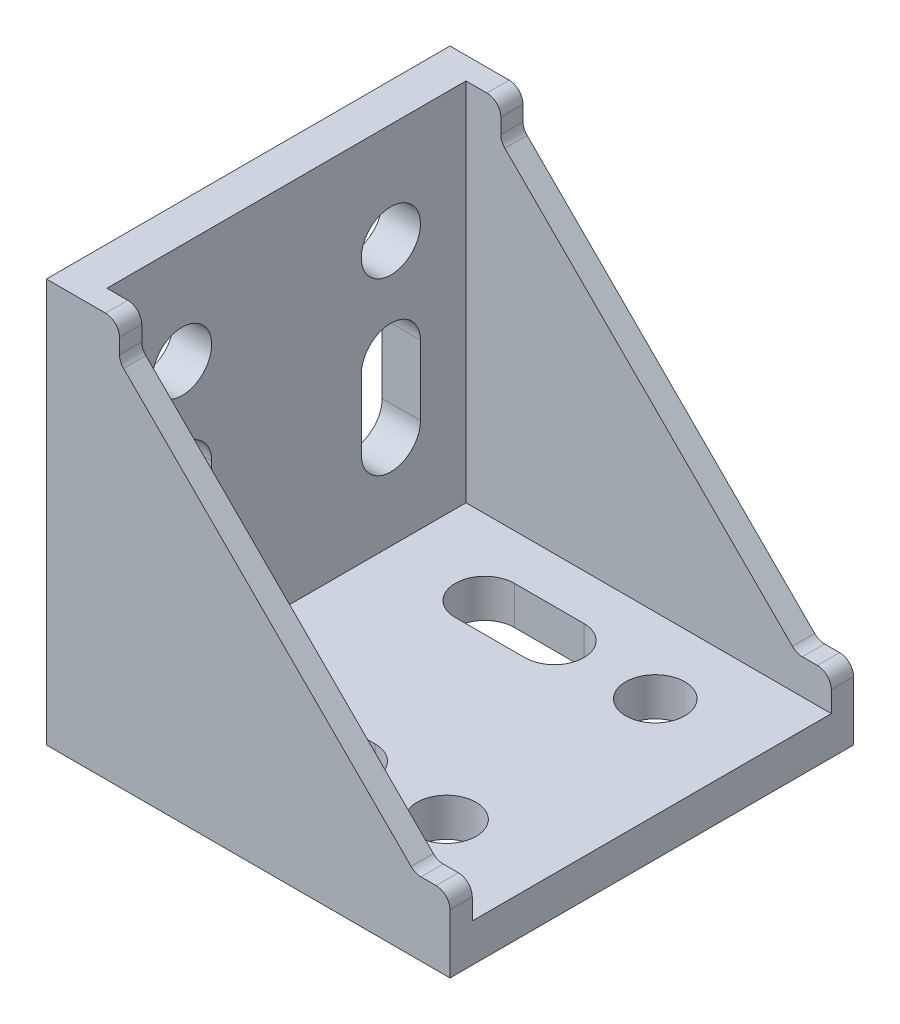
from build123d import *

# Parameters (mm, degrees)
EXTRUDE_1_DEPTH     = 58
SKETCH_2_R          = 4.25
CUT_EXTRUDE_1_DEPTH = 58.5
SKETCH_3_R          = 4.25
CUT_EXTRUDE_2_DEPTH = 58.5
EXTRUDE_2_DEPTH     = 3.2
EXTRUDE_3_DEPTH     = 3.2
FILLET_1_R          = 2


with BuildPart() as part:
    # 草图1 → 凸台-拉伸1 (new body)
    with BuildSketch(Plane.XY):
        Polygon((0, 58), (0, 0), (58, 0), (58, 5.5), (5.5, 5.5), (5.5, 58), align=None)
    extrude(amount=EXTRUDE_1_DEPTH)

    # 草图2 → 切除-拉伸1 (cut)
    with BuildSketch(Plane.XZ):
        with Locations(Location((43.5, 44, 0), (0, 0, 270))):
            Circle(SKETCH_2_R)
        with Locations((43.5, 14)):
            Circle(SKETCH_2_R)
        with BuildLine():
            Line((19, 48.25), (29, 48.25))
            ThreePointArc((29, 48.25), (33.25, 44), (29, 39.75))
            Line((29, 39.75), (19, 39.75))
            ThreePointArc((19, 39.75), (14.75, 44), (19, 48.25))
        make_face()
        with BuildLine():
            Line((19, 9.75), (29, 9.75))
            ThreePointArc((29, 9.75), (33.25, 14), (29, 18.25))
            Line((29, 18.25), (19, 18.25))
            ThreePointArc((19, 18.25), (14.75, 14), (19, 9.75))
        make_face()
    extrude(amount=-CUT_EXTRUDE_1_DEPTH, mode=Mode.SUBTRACT)

    # 草图3 → 切除-拉伸2 (cut)
    with BuildSketch(Plane.ZY):
        with Locations(Location((44, 43.5, 0), (0, 0, 270))):
            Circle(SKETCH_3_R)
        with Locations(Location((14, 43.5, 0), (0, 0, 270))):
            Circle(SKETCH_3_R)
        with BuildLine():
            Line((39.75, 29), (39.75, 19))
            ThreePointArc((39.75, 19), (44, 14.75), (48.25, 19))
            Line((48.25, 19), (48.25, 29))
            ThreePointArc((48.25, 29), (44, 33.25), (39.75, 29))
        make_face()
        with BuildLine():
            Line((9.75, 29), (9.75, 19))
            ThreePointArc((9.75, 19), (14, 14.75), (18.25, 19))
            Line((18.25, 19), (18.25, 29))
            ThreePointArc((18.25, 29), (14, 33.25), (9.75, 29))
        make_face()
    extrude(amount=-CUT_EXTRUDE_2_DEPTH, mode=Mode.SUBTRACT)

    # 草图4 → 凸台-拉伸2 (add)
    with BuildSketch(Plane.XY.offset(58)):
        Polygon((5.5, 58), (10.5, 58), (10.5, 53), (53, 10.5), (58, 10.5), (58, 5.5), (5.5, 5.5), align=None)
    extrude(amount=-EXTRUDE_2_DEPTH)

    # 草图5 → 凸台-拉伸3 (add)
    with BuildSketch(Plane(origin=(0, 0, 0), x_dir=(-1, 0, 0), z_dir=(0, 0, -1))):
        Polygon((-10.5, 58), (-10.5, 53), (-53, 10.5), (-58, 10.5), (-58, 5.5), (-5.5, 5.5), (-5.5, 58), align=None)
    extrude(amount=-EXTRUDE_3_DEPTH)

    # 圆角1
    fillet_1_edges = [part.edges().sort_by_distance(p)[0] for p in [
        (10.5, 58, 56.4),
        (10.5, 53, 56.4),
        (53, 10.5, 56.4),
        (58, 10.5, 56.4),
        (10.5, 53, 1.6),
        (10.5, 58, 1.6),
        (58, 10.5, 1.6),
        (53, 10.5, 1.6),
    ]]
    fillet(fillet_1_edges, radius=FILLET_1_R)


solid = part.part
